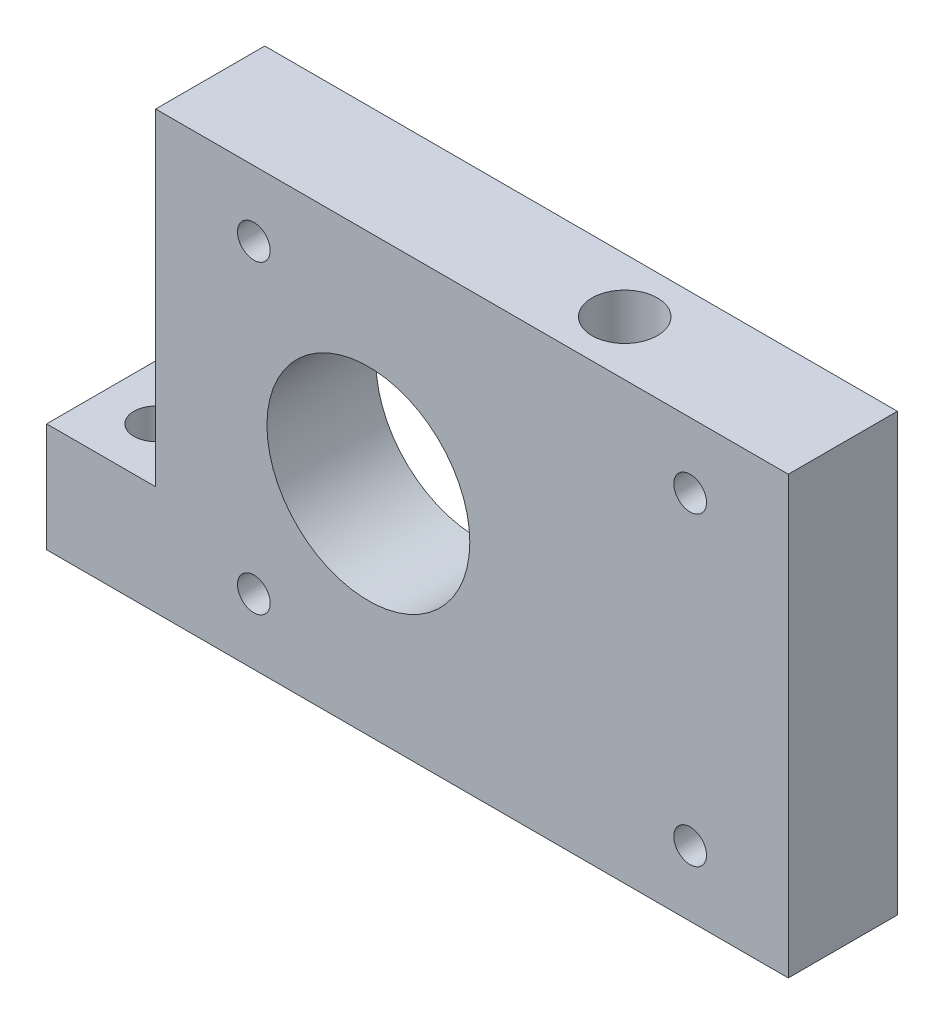
from build123d import *

# Parameters (mm, degrees)
SKETCH1_R             = 3.9
SKETCH1_R_2           = 1.5
BOSS_EXTRUDE1_DEPTH   = 10.061552014
BOSS_EXTRUDE1_2_DEPTH = 10.061552014
BOSS_EXTRUDE1_3_DEPTH = 10.061552014
BOSS_EXTRUDE1_4_DEPTH = 10.061552014
BOSS_EXTRUDE2_START   = 1.861552
SKETCH2_R             = 3.9
SKETCH2_R_2           = 9.3
BOSS_EXTRUDE2_DEPTH   = 10
CUT_EXTRUDE1_DEPTH    = 25
CUT_EXTRUDE2_DEPTH    = 72.170463178
SKETCH5_W             = 10
SKETCH5_H             = 10
SKETCH5_R             = 2
BOSS_EXTRUDE3_DEPTH   = 10


with BuildPart() as part:
    # Sketch1 → Boss-Extrude1 (new body)
    with BuildSketch(Plane.XY):
        with Locations(Location((-49, 7.83595021, 0), (0, 0, 180))):
            Circle(SKETCH1_R)
        with Locations(Location((-49, 7.83595021, 0), (0, 0, 180))):
            Circle(SKETCH1_R_2, mode=Mode.SUBTRACT)
    extrude(amount=BOSS_EXTRUDE1_DEPTH)



with BuildPart() as body_2:
    # Sketch1 → Boss-Extrude1 2 (new body)
    with BuildSketch(Plane.XY):
        with Locations(Location((-49, 35.83595021, 0), (0, 0, 180))):
            Circle(SKETCH1_R)
        with Locations(Location((-49, 35.83595021, 0), (0, 0, 180))):
            Circle(SKETCH1_R_2, mode=Mode.SUBTRACT)
    extrude(amount=BOSS_EXTRUDE1_2_DEPTH)


with BuildPart() as body_3:
    # Sketch1 → Boss-Extrude1 3 (new body)
    with BuildSketch(Plane.XY):
        with Locations(Location((-9, 35.83595021, 0), (0, 0, 180))):
            Circle(SKETCH1_R)
        with Locations(Location((-9, 35.83595021, 0), (0, 0, 180))):
            Circle(SKETCH1_R_2, mode=Mode.SUBTRACT)
    extrude(amount=BOSS_EXTRUDE1_3_DEPTH)


with BuildPart() as body_4:
    # Sketch1 → Boss-Extrude1 4 (new body)
    with BuildSketch(Plane.XY):
        with Locations(Location((-9, 7.83595021, 0), (0, 0, 180))):
            Circle(SKETCH1_R)
        with Locations(Location((-9, 7.83595021, 0), (0, 0, 180))):
            Circle(SKETCH1_R_2, mode=Mode.SUBTRACT)
    extrude(amount=BOSS_EXTRUDE1_4_DEPTH)


with BuildPart() as part_1:
    add(part.part)

    add(body_2.part)  # Boss-Extrude2 merges body 2

    add(body_3.part)  # Boss-Extrude2 merges body 3

    add(body_4.part)  # Boss-Extrude2 merges body 4
    # Sketch2 → Boss-Extrude2 (add)
    with BuildSketch(Plane.XY.offset(-1.8).offset(BOSS_EXTRUDE2_START)):
        Polygon((-58, 1.83595021), (0, 1.83595021), (0, 5.290014366), (0, 38.441339865), (0, 41.83595021), (-58, 41.83595021), align=None)
        with Locations(Location((-9, 35.83595021, 0), (0, 0, 180))):
            Circle(SKETCH2_R, mode=Mode.SUBTRACT)
        with Locations((-49, 7.83595021)):
            Circle(SKETCH2_R, mode=Mode.SUBTRACT)
        with Locations(Location((-38.5, 21.83595021, 0), (0, 0, 180))):
            Circle(SKETCH2_R_2, mode=Mode.SUBTRACT)
        with Locations(Location((-49, 35.83595021, 0), (0, 0, 180))):
            Circle(SKETCH2_R, mode=Mode.SUBTRACT)
        with Locations(Location((-9, 7.83595021, 0), (0, 0, 180))):
            Circle(SKETCH2_R, mode=Mode.SUBTRACT)
    extrude(amount=BOSS_EXTRUDE2_DEPTH)

    # Sketch4 → Cut-Extrude1 (cut)
    with BuildSketch(Plane(origin=(0, 41.83595021, 0), x_dir=(1, 0, 0), z_dir=(0, 1, 0))):
        with BuildLine():
            ThreePointArc((-23, -5.061552014), (-20, -8.061552014), (-17, -5.061552014))
            Line((-17, -5.061552014), (-18, -5.061552014))
            ThreePointArc((-18, -5.061552014), (-20, -7.061552014), (-22, -5.061552014))
            Line((-22, -5.061552014), (-23, -5.061552014))
        make_face()
        with BuildLine():
            Line((-18, -5.061552014), (-17, -5.061552014))
            ThreePointArc((-17, -5.061552014), (-20, -2.061552014), (-23, -5.061552014))
            Line((-23, -5.061552014), (-22, -5.061552014))
            ThreePointArc((-22, -5.061552014), (-20, -3.061552014), (-18, -5.061552014))
        make_face()
        with BuildLine():
            ThreePointArc((-22, -5.061552014), (-20, -7.061552014), (-18, -5.061552014))
            Line((-18, -5.061552014), (-22, -5.061552014))
        make_face()
        with BuildLine():
            Line((-22, -5.061552014), (-18, -5.061552014))
            ThreePointArc((-18, -5.061552014), (-20, -3.061552014), (-22, -5.061552014))
        make_face()
    extrude(amount=-CUT_EXTRUDE1_DEPTH, mode=Mode.SUBTRACT)

    # Sketch4<3> → Cut-Extrude2 (cut, through all)
    with BuildSketch(Plane(origin=(0, 41.83595021, 0), x_dir=(1, 0, 0), z_dir=(0, 1, 0))):
        with BuildLine():
            ThreePointArc((-22, -5.061552014), (-20, -7.061552014), (-18, -5.061552014))
            Line((-18, -5.061552014), (-22, -5.061552014))
        make_face()
        with BuildLine():
            Line((-22, -5.061552014), (-18, -5.061552014))
            ThreePointArc((-18, -5.061552014), (-20, -3.061552014), (-22, -5.061552014))
        make_face()
    extrude(amount=-CUT_EXTRUDE2_DEPTH, mode=Mode.SUBTRACT)

    # Sketch5 → Boss-Extrude3 (add)
    with BuildSketch(Plane(origin=(0, 1.83595021, 0), x_dir=(1, 0, 0), z_dir=(0, 1, 0))):
        with Locations((-63, -5.061552014)):
            Rectangle(SKETCH5_W, SKETCH5_H)
        with Locations(Location((-63, -5.061552014, 0), (0, 0, 180))):
            Circle(SKETCH5_R, mode=Mode.SUBTRACT)
    extrude(amount=BOSS_EXTRUDE3_DEPTH)


solid = part_1.part
